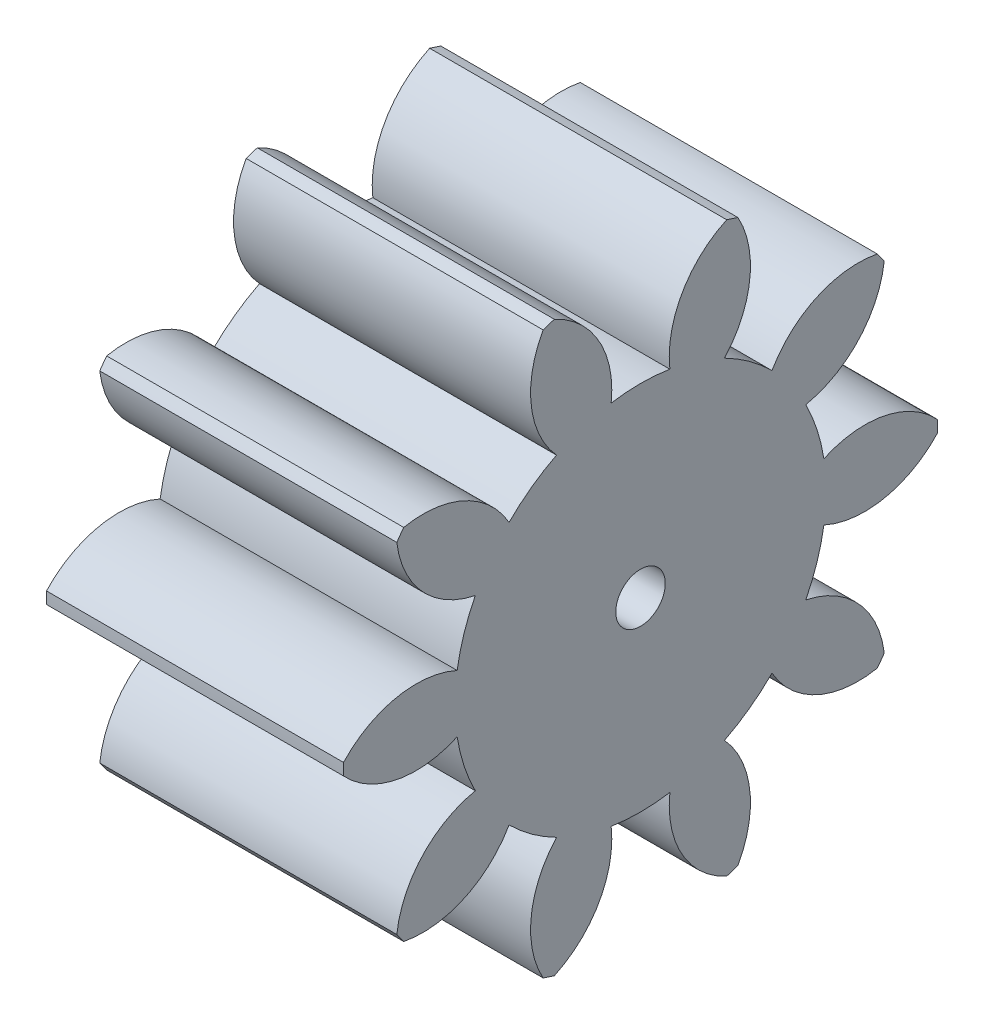
from build123d import *

# Parameters (mm, degrees)
BASPROSKE_W     = 6
BASPROSKE_H     = 6
TOOTHCUT_DEPTH  = 11.392304845
TEETHCUTS_COUNT = 10
TEETHCUTS_ANGLE = 324
BORSKE_R        = 0.5
BORE_DEPTH      = 50.0000508


with BuildPart() as part:
    # BasProSke → Base-Revolve (revolve)
    with BuildSketch(Plane(origin=(0, 0, 0), x_dir=(1, 0, 0), z_dir=(0, 1, 0)), mode=Mode.PRIVATE) as base_revolve_sk:
        with Locations((3, 3)):
            Rectangle(BASPROSKE_W, BASPROSKE_H)
    revolve(base_revolve_sk.sketch.rotate(Axis((-10, 0, 0), (1, 0, 0)), 180), axis=Axis((-10, 0, 0), (1, 0, 0)))

    # TooCutSke → ToothCut (cut, through all)
    with BuildSketch(Plane(origin=(0, 0, 0), x_dir=(0, 0, -1), z_dir=(1, 0, 0))):
        with BuildLine():
            ThreePointArc((0.59278292, 3.701838653), (0, 3.749), (-0.59278292, 3.701838653))
            ThreePointArc((-0.59278292, 3.701838653), (-0.846593509, 4.924114224), (-1.775771316, 5.757784417))
            ThreePointArc((-1.775771316, 5.757784417), (0, 6.0254), (1.775771316, 5.757784417))
            ThreePointArc((1.775771316, 5.757784417), (0.846593509, 4.924114224), (0.59278292, 3.701838653))
        make_face()
    toothcut = extrude(amount=TOOTHCUT_DEPTH, mode=Mode.SUBTRACT)

    # TeethCuts: ToothCut ×10 about axis
    teethcuts_axis = Axis((-10, 0, 0), (1, 0, 0))
    for i in range(1, TEETHCUTS_COUNT):
        add(toothcut.rotate(teethcuts_axis, i * TEETHCUTS_ANGLE / (TEETHCUTS_COUNT - 1)), mode=Mode.SUBTRACT)

    # BorSke → Bore (cut, symmetric)
    with BuildSketch(Plane(origin=(0, 0, 0), x_dir=(0, 0, -1), z_dir=(1, 0, 0))):
        with Locations(Location((0, 0, 0), (0, 0, 180))):
            Circle(BORSKE_R)
    extrude(amount=BORE_DEPTH, both=True, mode=Mode.SUBTRACT)


solid = part.part
